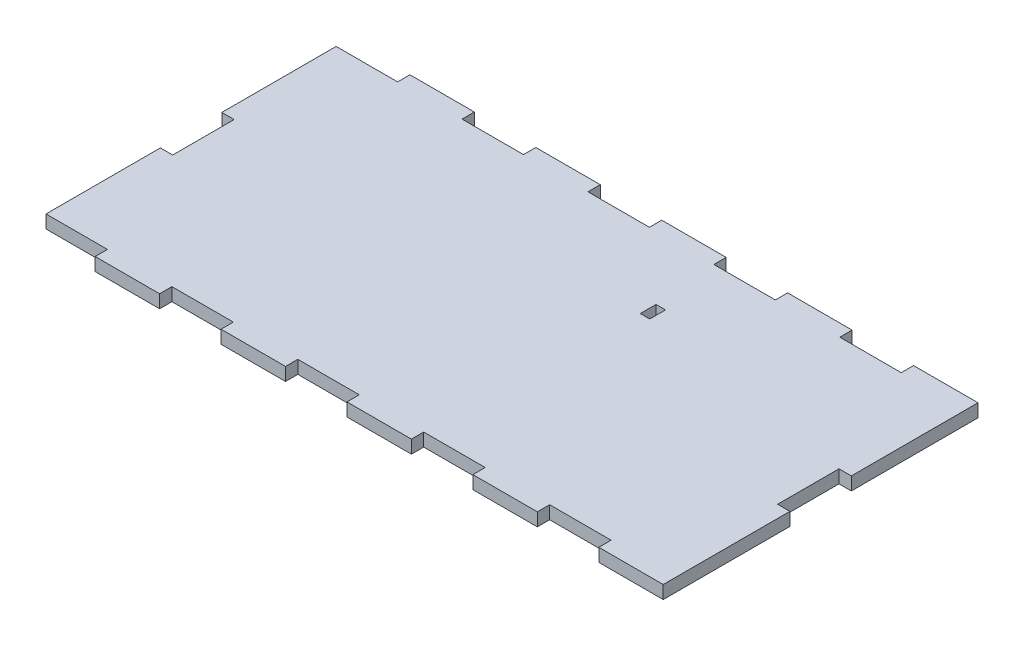
from build123d import *

# Parameters (mm, degrees)
SKETCH1_W           = 200
SKETCH1_H           = 100
BOSS_EXTRUDE1_DEPTH = 4.15
SKETCH3_W           = 19.52
SKETCH3_H           = 3.91
CUT_EXTRUDE2_DEPTH  = 10
SKETCH4_W           = 3.91
SKETCH4_H           = 19.52
CUT_EXTRUDE3_DEPTH  = 10
SKETCH21_W          = 3
SKETCH21_H          = 5
CUT_EXTRUDE22_DEPTH = 4.2


with BuildPart() as part:
    # Sketch1 → Boss-Extrude1 (new body)
    with BuildSketch(Plane(origin=(0, 0, 0), x_dir=(1, 0, 0), z_dir=(0, 1, 0))):
        Rectangle(SKETCH1_W, SKETCH1_H)
    extrude(amount=BOSS_EXTRUDE1_DEPTH)

    # Sketch3 → Cut-Extrude2 (cut)
    with BuildSketch(Plane(origin=(0, 4.15, 0), x_dir=(1, 0, 0), z_dir=(0, 1, 0))):
        with Locations((-90.24, 48.045)):
            Rectangle(SKETCH3_W, SKETCH3_H)
        with Locations((-90.24, -48.045)):
            Rectangle(SKETCH3_W, SKETCH3_H)
        with Locations((-50.24, 48.045)):
            Rectangle(SKETCH3_W, SKETCH3_H)
        with Locations((-10.24, 48.045)):
            Rectangle(SKETCH3_W, SKETCH3_H)
        with Locations((29.76, 48.045)):
            Rectangle(SKETCH3_W, SKETCH3_H)
        with Locations((69.76, 48.045)):
            Rectangle(SKETCH3_W, SKETCH3_H)
        with Locations((-50.24, -48.045)):
            Rectangle(SKETCH3_W, SKETCH3_H)
        with Locations((-10.24, -48.045)):
            Rectangle(SKETCH3_W, SKETCH3_H)
        with Locations((29.76, -48.045)):
            Rectangle(SKETCH3_W, SKETCH3_H)
        with Locations((69.76, -48.045)):
            Rectangle(SKETCH3_W, SKETCH3_H)
    extrude(amount=-CUT_EXTRUDE2_DEPTH, mode=Mode.SUBTRACT)

    # Sketch4 → Cut-Extrude3 (cut)
    with BuildSketch(Plane(origin=(0, 4.15, 0), x_dir=(1, 0, 0), z_dir=(0, 1, 0))):
        with Locations((-98.045, 0)):
            Rectangle(SKETCH4_W, SKETCH4_H)
        with Locations((98.045, 0)):
            Rectangle(SKETCH4_W, SKETCH4_H)
    extrude(amount=-CUT_EXTRUDE3_DEPTH, mode=Mode.SUBTRACT)

    # Sketch21 → Cut-Extrude22 (cut)
    with BuildSketch(Plane(origin=(0, 4.15, 0), x_dir=(1, 0, 0), z_dir=(0, 1, 0))):
        with Locations((23.31, 23.41)):
            Rectangle(SKETCH21_W, SKETCH21_H)
    extrude(amount=-CUT_EXTRUDE22_DEPTH, mode=Mode.SUBTRACT)


solid = part.part
